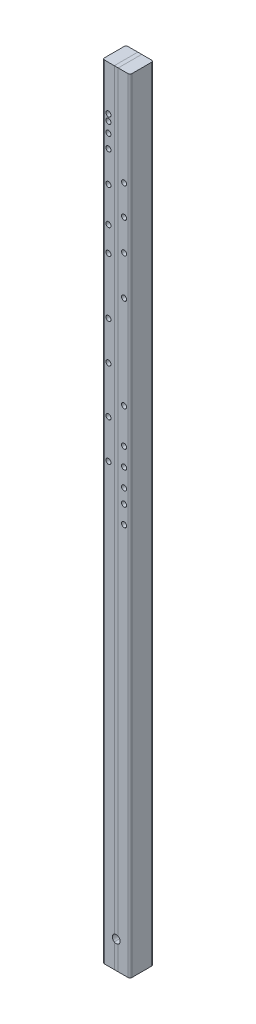
from build123d import *

# Parameters (mm, degrees)
SKETCH1_W            = 38.1
SKETCH1_H            = 1270
BOSS_EXTRUDE1_DEPTH  = 3.175
SKETCH8_W            = 38.1
SKETCH8_H            = 1270
BOSS_EXTRUDE2_DEPTH  = 19.05
FILLET1_R            = 3.175
SKETCH22_W           = 19.05
SKETCH22_H           = 609.6
CUT_EXTRUDE7_DEPTH   = 25.4
SKETCH2_R            = 6.35
EYEBOLT_ANCHOR_DEPTH = 637.530094045
SKETCH5_R            = 1.905
CUT_EXTRUDE3_DEPTH   = 637.530094045
SKETCH6_R            = 4.1275
CUT_EXTRUDE4_DEPTH   = 7.747


with BuildPart() as part:
    # Sketch1 → Boss-Extrude1 (new, symmetric)
    with BuildSketch(Plane(origin=(0, 0, 0), x_dir=(0, 0, -1), z_dir=(1, 0, 0))):
        Rectangle(SKETCH1_W, SKETCH1_H)
    extrude(amount=BOSS_EXTRUDE1_DEPTH, both=True)


with BuildPart() as body_2:
    # Sketch8 → Boss-Extrude2 (new body)
    with BuildSketch(Plane(origin=(3.175, 0, 0), x_dir=(0, 0, -1), z_dir=(1, 0, 0))):
        Rectangle(SKETCH8_W, SKETCH8_H)
    extrude(amount=BOSS_EXTRUDE2_DEPTH)

    # Fillet1
    fillet1_edges = [body_2.edges().sort_by_distance(p)[0] for p in [
        (22.225, 0, -19.05),
        (22.225, 0, 19.05),
    ]]
    fillet(fillet1_edges, radius=FILLET1_R)


with BuildPart() as body_3:
    # Mirror3: mirrored copy
    add(body_2.part.mirror(Plane(origin=(0, 0, 0), x_dir=(0, 0, 1), z_dir=(1, 0, 0))))


with BuildPart() as cut_extrude7_tool:
    # Sketch22 → Cut-Extrude7 (new body)
    with BuildSketch(Plane(origin=(0, 0, -19.05), x_dir=(-1, 0, 0), z_dir=(0, 0, -1))):
        with Locations((0, 304.8)):
            Rectangle(SKETCH22_W, SKETCH22_H)
    extrude(amount=-CUT_EXTRUDE7_DEPTH)


with BuildPart() as part_1:
    add(part.part)

    # Cut-Extrude7: cut by cut_extrude7_tool
    add(cut_extrude7_tool.part, mode=Mode.SUBTRACT)


with BuildPart() as body_2_1:
    add(body_2.part)

    # Cut-Extrude7: cut by cut_extrude7_tool
    add(cut_extrude7_tool.part, mode=Mode.SUBTRACT)


with BuildPart() as body_3_1:
    add(body_3.part)

    # Cut-Extrude7: cut by cut_extrude7_tool
    add(cut_extrude7_tool.part, mode=Mode.SUBTRACT)


with BuildPart() as eyebolt_anchor_tool:
    # Sketch2 → Eyebolt Anchor (new, through all)
    with BuildSketch(Plane.XY.offset(19.05)):
        with Locations((0, -590.55)):
            Circle(SKETCH2_R)
    extrude(amount=-EYEBOLT_ANCHOR_DEPTH)


with BuildPart() as part_2:
    add(part_1.part)

    # Eyebolt Anchor: cut by eyebolt_anchor_tool
    add(eyebolt_anchor_tool.part, mode=Mode.SUBTRACT)


with BuildPart() as body_2_2:
    add(body_2_1.part)

    # Eyebolt Anchor: cut by eyebolt_anchor_tool
    add(eyebolt_anchor_tool.part, mode=Mode.SUBTRACT)


with BuildPart() as body_3_2:
    add(body_3_1.part)

    # Eyebolt Anchor: cut by eyebolt_anchor_tool
    add(eyebolt_anchor_tool.part, mode=Mode.SUBTRACT)


with BuildPart() as cut_extrude3_tool:
    # Sketch5 → Cut-Extrude3 (new, through all)
    with BuildSketch(Plane.XY.offset(19.05)):
        with Locations((-12.7, 513.302135886)):
            Circle(SKETCH5_R)
        with Locations((12.7, 478.263647874)):
            Circle(SKETCH5_R)
        with Locations((-12.7, 463.345550332)):
            Circle(SKETCH5_R)
        with Locations((12.7, 430.113859098)):
            Circle(SKETCH5_R)
        with Locations((-12.7, 407.064148942)):
            Circle(SKETCH5_R)
        with Locations((12.7, 379.842698104)):
            Circle(SKETCH5_R)
        with Locations((-12.7, 366.551491472)):
            Circle(SKETCH5_R)
        with Locations((12.7, 316.418969048)):
            Circle(SKETCH5_R)
        with Locations((-12.7, 535.422112699)):
            Circle(SKETCH5_R)
        with Locations((-12.7, 552.28498253)):
            Circle(SKETCH5_R)
        with Locations((-12.7, 562.430692594)):
            Circle(SKETCH5_R)
        with Locations((12.7, 165.149796436)):
            Circle(SKETCH5_R)
        with Locations((12.7, 108.45633512)):
            Circle(SKETCH5_R)
        with Locations((12.7, 79.058526758)):
            Circle(SKETCH5_R)
        with Locations((12.7, 49.653866377)):
            Circle(SKETCH5_R)
        with Locations((12.7, 27.043187605)):
            Circle(SKETCH5_R)
        with Locations((12.7, -1.905)):
            Circle(SKETCH5_R)
        with Locations((-12.7, 74.386924519)):
            Circle(SKETCH5_R)
        with Locations((-12.7, 137.013245544)):
            Circle(SKETCH5_R)
        with Locations((-12.7, 212.596714918)):
            Circle(SKETCH5_R)
        with Locations((-12.7, 275.179690854)):
            Circle(SKETCH5_R)
    extrude(amount=-CUT_EXTRUDE3_DEPTH)


with BuildPart() as body_2_3:
    add(body_2_2.part)

    # Cut-Extrude3: cut by cut_extrude3_tool
    add(cut_extrude3_tool.part, mode=Mode.SUBTRACT)


with BuildPart() as body_3_3:
    add(body_3_2.part)

    # Cut-Extrude3: cut by cut_extrude3_tool
    add(cut_extrude3_tool.part, mode=Mode.SUBTRACT)


with BuildPart() as cut_extrude4_tool:
    # Sketch6 → Cut-Extrude4 (new body)
    with BuildSketch(Plane.XY.offset(19.05)):
        with Locations((-12.7, 513.302135886)):
            Circle(SKETCH6_R)
        with Locations((12.7, 478.263647874)):
            Circle(SKETCH6_R)
        with Locations((-12.7, 463.345550332)):
            Circle(SKETCH6_R)
        with Locations((12.7, 430.113859098)):
            Circle(SKETCH6_R)
        with Locations((12.7, 379.842698104)):
            Circle(SKETCH6_R)
        with Locations((12.7, 316.418969048)):
            Circle(SKETCH6_R)
        with Locations((-12.7, 366.551491472)):
            Circle(SKETCH6_R)
        with Locations((-12.7, 407.064148942)):
            Circle(SKETCH6_R)
        with Locations((-12.7, 562.430692594)):
            Circle(SKETCH6_R)
        with Locations((-12.7, 552.28498253)):
            Circle(SKETCH6_R)
        with Locations((-12.7, 535.422112699)):
            Circle(SKETCH6_R)
        with Locations((-12.7, 275.179690854)):
            Circle(SKETCH6_R)
        with Locations((-12.7, 212.596714918)):
            Circle(SKETCH6_R)
        with Locations((12.7, 165.149796436)):
            Circle(SKETCH6_R)
        with Locations((-12.7, 137.013245544)):
            Circle(SKETCH6_R)
        with Locations((12.7, 108.45633512)):
            Circle(SKETCH6_R)
        with Locations((12.7, 79.058526758)):
            Circle(SKETCH6_R)
        with Locations((-12.7, 74.386924519)):
            Circle(SKETCH6_R)
        with Locations((12.7, 49.653866377)):
            Circle(SKETCH6_R)
        with Locations((12.7, 27.043187605)):
            Circle(SKETCH6_R)
        with Locations((12.7, -1.905)):
            Circle(SKETCH6_R)
    extrude(amount=-CUT_EXTRUDE4_DEPTH)


with BuildPart() as body_2_4:
    add(body_2_3.part)

    # Cut-Extrude4: cut by cut_extrude4_tool
    add(cut_extrude4_tool.part, mode=Mode.SUBTRACT)


with BuildPart() as body_3_4:
    add(body_3_3.part)

    # Cut-Extrude4: cut by cut_extrude4_tool
    add(cut_extrude4_tool.part, mode=Mode.SUBTRACT)


solid = Compound([part_2.part, body_2_4.part, body_3_4.part])
